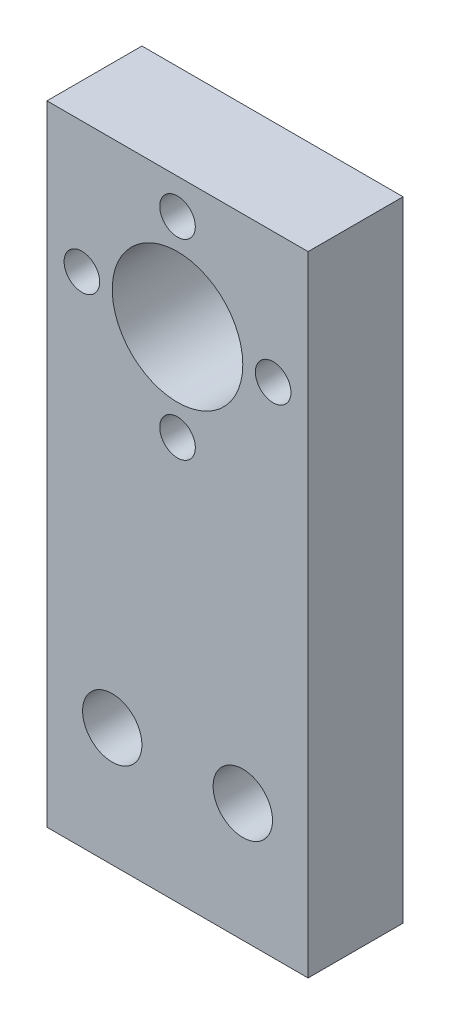
from build123d import *

# Parameters (mm, degrees)
SKETCH_1_W      = 22
SKETCH_1_H      = 53
SKETCH_1_R      = 2.5
SKETCH_1_R_2    = 5.5
SKETCH_1_R_3    = 1.5
EXTRUDE_1_DEPTH = 8


with BuildPart() as part:
    # 草图1 → 凸台-拉伸1 (new body)
    with BuildSketch(Plane.XY):
        with Locations((-7.008849558, -2.699115044)):
            Rectangle(SKETCH_1_W, SKETCH_1_H)
        with Locations((-12.508849558, -19.199115044)):
            Circle(SKETCH_1_R, mode=Mode.SUBTRACT)
        with Locations((-1.508849558, -19.199115044)):
            Circle(SKETCH_1_R, mode=Mode.SUBTRACT)
        with Locations((-7.008849558, 12.800884956)):
            Circle(SKETCH_1_R_2, mode=Mode.SUBTRACT)
        with Locations((-7.008849558, 20.858941567)):
            Circle(SKETCH_1_R_3, mode=Mode.SUBTRACT)
        with Locations((1.049207054, 12.800884956)):
            Circle(SKETCH_1_R_3, mode=Mode.SUBTRACT)
        with Locations((-7.008849558, 4.742828344)):
            Circle(SKETCH_1_R_3, mode=Mode.SUBTRACT)
        with Locations((-15.066906169, 12.800884956)):
            Circle(SKETCH_1_R_3, mode=Mode.SUBTRACT)
    extrude(amount=EXTRUDE_1_DEPTH)


solid = part.part
